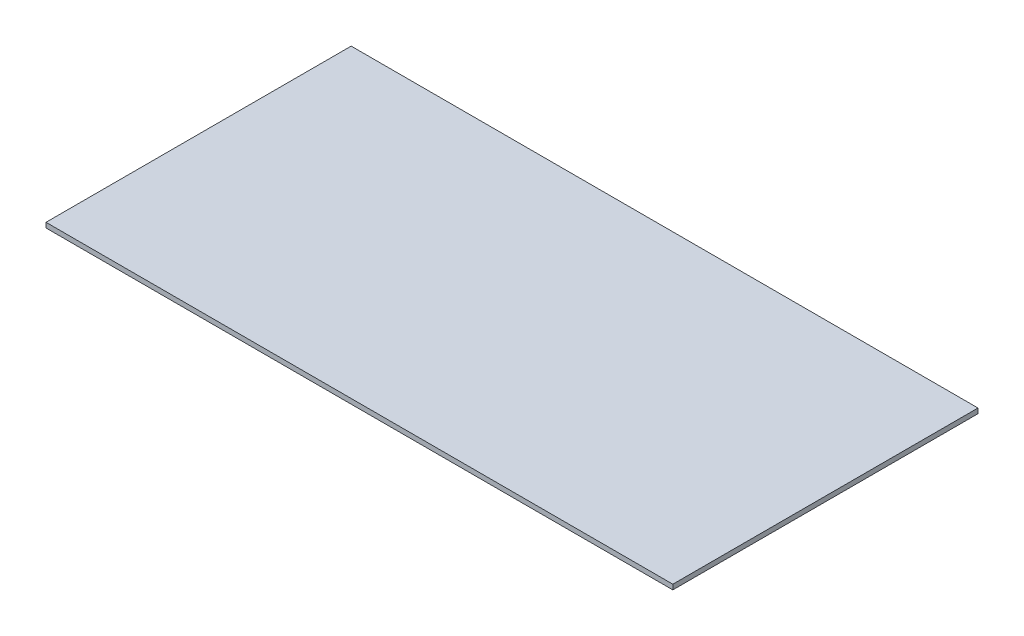
from build123d import *

# Parameters (mm, degrees)
SKETCH1_W           = 190
SKETCH1_H           = 92.5
BOSS_EXTRUDE1_DEPTH = 1.5


with BuildPart() as part:
    # Sketch1 → Boss-Extrude1 (new body)
    with BuildSketch(Plane(origin=(0, 0, 0), x_dir=(1, 0, 0), z_dir=(0, 1, 0))):
        with Locations((95, 46.25)):
            Rectangle(SKETCH1_W, SKETCH1_H)
    extrude(amount=BOSS_EXTRUDE1_DEPTH)


solid = part.part
